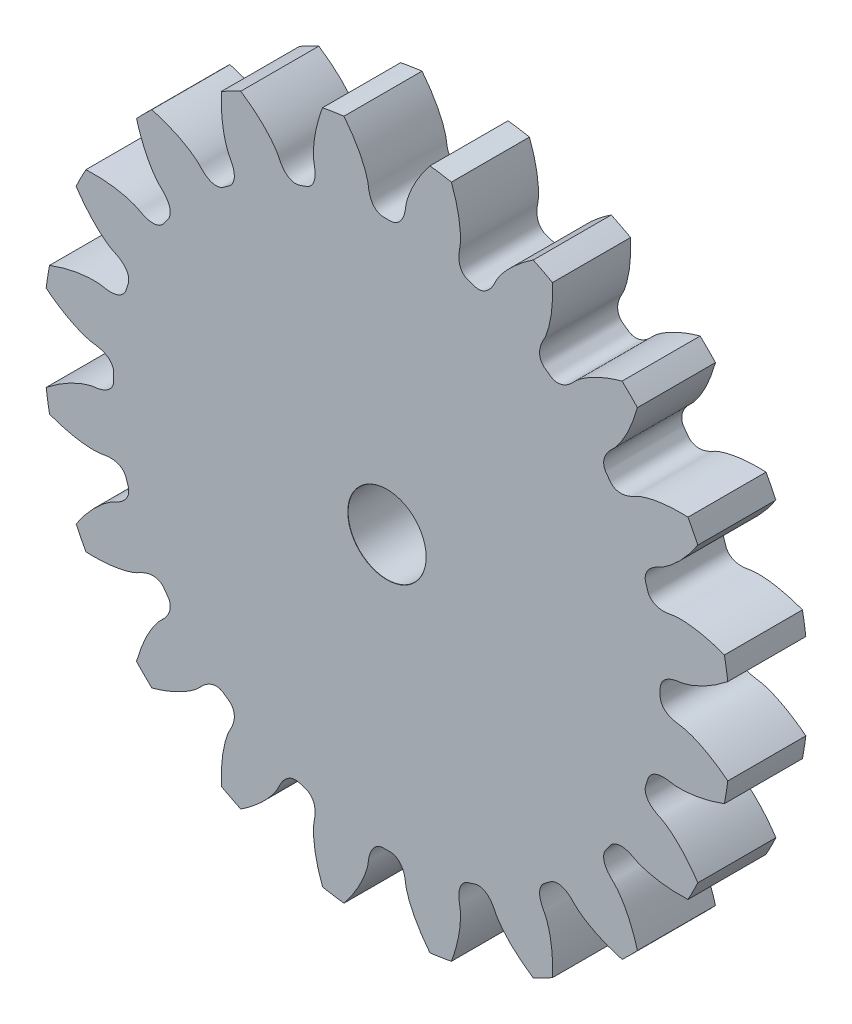
from build123d import *

# Parameters (mm, degrees)
SKETCHREVOLVESPUR06_W       = 5.000000376
SKETCHREVOLVESPUR06_H       = 21.99999967
TOOTHEXTRUDECUTSPUR06_DEPTH = 2.500000188
PATTERNSPUR06_COUNT         = 20


with BuildPart() as part:
    # SketchRevolveSpur06 → Spur06 (revolve)
    with BuildSketch(Plane(origin=(0, 0, 0), x_dir=(0, 0, -1), z_dir=(1, 0, 0))):
        with Locations((0, 10.999999835)):
            Rectangle(SKETCHREVOLVESPUR06_W, SKETCHREVOLVESPUR06_H)
    revolve(axis=Axis((0, 0, 0), (0, 0, -1)))

    # SketchToothSpur06 → ToothExtrudeCutSpur06 (cut, symmetric)
    with BuildSketch(Plane.XY):
        with BuildLine():
            ThreePointArc((21.918421238, 2.827153298), (22.099999668, 0), (21.918421238, -2.827153298))
            add(Edge.make_bspline(
                [(21.918421238, -2.827153298), (21.741617929, -2.683509489), (21.477230226, -2.481239513), (21.122274115, -2.235558602), (20.873138621, -2.07427592), (20.634532489, -1.930071682), (20.407259048, -1.802131636), (20.19208107, -1.689608255), (19.989719488, -1.591622978), (19.800852228, -1.507267774), (19.626113058, -1.435607351), (19.466090681, -1.37567986), (19.321327334, -1.326502545), (19.192319268, -1.287061881), (19.079511696, -1.256352015), (18.983310772, -1.233267357), (18.904046107, -1.216921425), (18.820427061, -1.20188638), (18.7434052, -1.193884095), (18.668466837, -1.184650263), (18.611741093, -1.176382298), (18.556149043, -1.167100943), (18.501669409, -1.156764611), (18.448275879, -1.14536787), (18.395939267, -1.132888043), (18.344626794, -1.119297713), (18.29430221, -1.104559719), (18.24492585, -1.088626396), (18.196454926, -1.071437317), (18.148844108, -1.052916977), (18.102046529, -1.032972002), (18.056015402, -1.011487935), (18.010706513, -0.988325624), (17.966081932, -0.963317258), (17.922115377, -0.93626228), (17.878799809, -0.90692355), (17.836157885, -0.87502447), (17.794255935, -0.840248194), (17.753221965, -0.802240706), (17.713267692, -0.760620247), (17.674713541, -0.714996363), (17.638013799, -0.665002167), (17.603775987, -0.610342894), (17.572766928, -0.550860838), (17.545889405, -0.486613014), (17.524138257, -0.417943565), (17.508456272, -0.345549567), (17.500426145, -0.275921573), (17.496922669, -0.160451885), (17.502394111, 0), (17.496922669, 0.160451885), (17.500426145, 0.275921573), (17.508456272, 0.345549567), (17.524138257, 0.417943565), (17.545889405, 0.486613014), (17.572766928, 0.550860838), (17.603775987, 0.610342894), (17.638013799, 0.665002167), (17.674713541, 0.714996363), (17.713267692, 0.760620247), (17.753221965, 0.802240706), (17.794255935, 0.840248194), (17.836157885, 0.87502447), (17.878799809, 0.90692355), (17.922115377, 0.93626228), (17.966081932, 0.963317258), (18.010706513, 0.988325624), (18.056015402, 1.011487935), (18.102046529, 1.032972002), (18.148844108, 1.052916977), (18.196454926, 1.071437317), (18.24492585, 1.088626396), (18.29430221, 1.104559719), (18.344626794, 1.119297713), (18.395939267, 1.132888043), (18.448275879, 1.14536787), (18.501669409, 1.156764611), (18.556149043, 1.167100943), (18.611741093, 1.176382298), (18.668466837, 1.184650263), (18.7434052, 1.193884095), (18.820427061, 1.20188638), (18.904046107, 1.216921425), (18.983310772, 1.233267357), (19.079511696, 1.256352015), (19.192319268, 1.287061881), (19.321327334, 1.326502545), (19.466090681, 1.37567986), (19.626113058, 1.435607351), (19.800852228, 1.507267774), (19.989719488, 1.591622978), (20.19208107, 1.689608255), (20.407259048, 1.802131636), (20.634532489, 1.930071682), (20.873138621, 2.07427592), (21.122274115, 2.235558602), (21.477230226, 2.481239513), (21.741617929, 2.683509489), (21.918421238, 2.827153298)],
                knots=[0, 0, 0, 0, 0.061396729, 0.089671539, 0.116330645, 0.141374048, 0.164801748, 0.186613744, 0.206810037, 0.225390626, 0.242355512, 0.257704695, 0.271438175, 0.283555951, 0.294058024, 0.302944393, 0.31021506, 0.315870023, 0.325834188, 0.331072952, 0.336221203, 0.341282954, 0.346262674, 0.351165358, 0.355996594, 0.360762649, 0.365470561, 0.370128246, 0.374744623, 0.379329739, 0.383894926, 0.388452953, 0.393018187, 0.397606751, 0.40223666, 0.406927895, 0.411702402, 0.416583927, 0.421597618, 0.426769285, 0.432124194, 0.437685276, 0.443470683, 0.449490757, 0.455744689, 0.462217452, 0.468877879, 0.475678822, 0.481074845, 0.5, 0.518925155, 0.524321178, 0.531122121, 0.537782548, 0.544255311, 0.550509243, 0.556529317, 0.562314724, 0.567875806, 0.573230715, 0.578402382, 0.583416073, 0.588297598, 0.593072105, 0.59776334, 0.602393249, 0.606981813, 0.611547047, 0.616105074, 0.620670261, 0.625255377, 0.629871754, 0.634529439, 0.639237351, 0.644003406, 0.648834642, 0.653737326, 0.658717046, 0.663778797, 0.668927048, 0.674165812, 0.684129977, 0.68978494, 0.697055607, 0.705941976, 0.716444049, 0.728561825, 0.742295305, 0.757644488, 0.774609374, 0.793189963, 0.813386256, 0.835198252, 0.858625952, 0.883669355, 0.910328461, 0.938603271, 1, 1, 1, 1], degree=3))
        make_face()
    toothextrudecutspur06 = extrude(amount=TOOTHEXTRUDECUTSPUR06_DEPTH, both=True, mode=Mode.SUBTRACT)

    # PatternSpur06: ToothExtrudeCutSpur06 ×20 about axis
    patternspur06_axis = Axis((0, 0, 55), (0, 0, -1))
    for i in range(1, PATTERNSPUR06_COUNT):
        add(toothextrudecutspur06.rotate(patternspur06_axis, i * 360 / PATTERNSPUR06_COUNT), mode=Mode.SUBTRACT)

    # BoreRevolveSketch → BoreRevolveCut (revolve, cut)
    with BuildSketch(Plane(origin=(0, 0, 0), x_dir=(0, 0, -1), z_dir=(1, 0, 0))):
        Polygon((-2.500000188, 0), (2.500000188, 0), (2.500000188, 2.51), (2.490000188, 2.5), (-2.490000188, 2.5), (-2.500000188, 2.51), align=None)
    revolve(axis=Axis((0, 0, 0), (0, 0, -1)), mode=Mode.SUBTRACT)


solid = part.part
